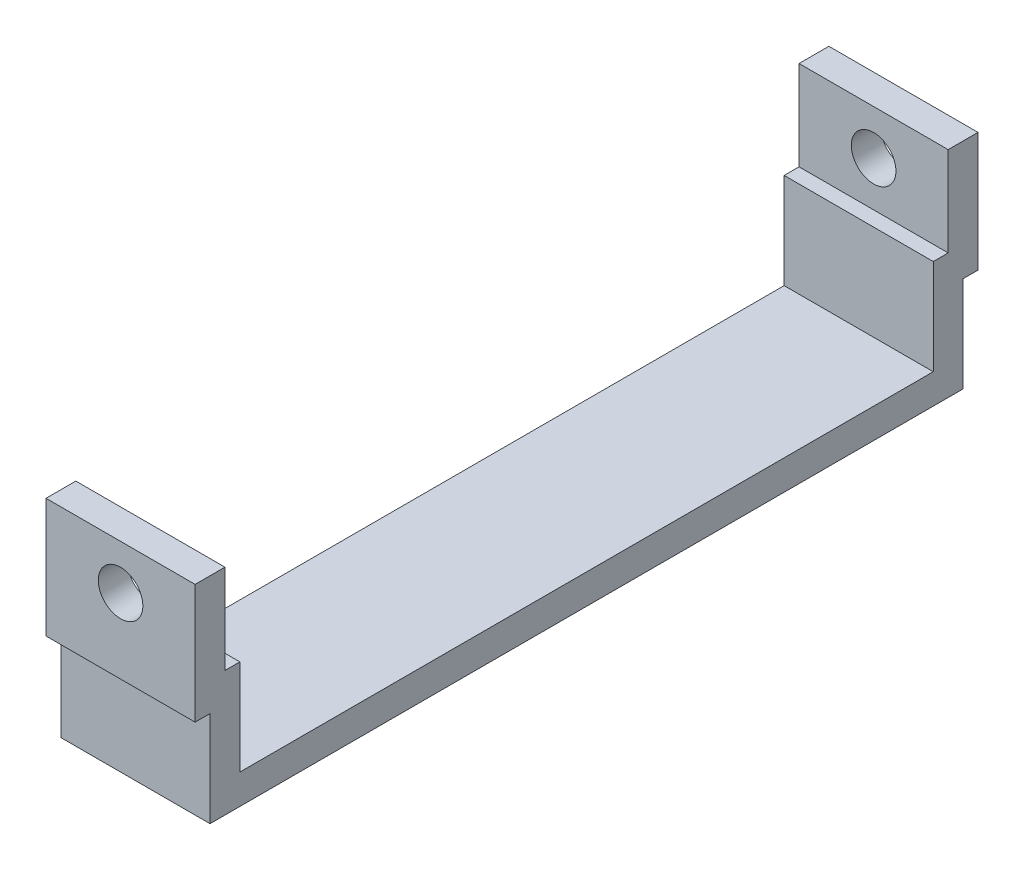
from build123d import *

# Parameters (mm, degrees)
EXTRUDE_THIN1_DEPTH       = 12.7
F_6_CLEARANCE_HOLE1_D     = 3.7973
F_6_CLEARANCE_HOLE1_DEPTH = 7.62
F_6_CLEARANCE_HOLE1_TIP   = 1.140824014
F_6_CLEARANCE_HOLE2_D     = 3.7973
F_6_CLEARANCE_HOLE2_DEPTH = 7.62
F_6_CLEARANCE_HOLE2_TIP   = 1.140824014


with BuildPart() as part:
    # Sketch1 → Extrude-Thin1 (new body)
    with BuildSketch(Plane(origin=(0, 0, 0), x_dir=(0, 0, -1), z_dir=(1, 0, 0))):
        Polygon((-1.27, 15.748), (-1.27, 8.128), (0, 8.128), (0, 0), (59.055, 0), (59.055, 8.128), (60.325, 8.128), (60.325, 15.748), (62.865, 15.748), (62.865, 5.588), (61.595, 5.588), (61.595, -2.54), (-2.54, -2.54), (-2.54, 5.588), (-3.81, 5.588), (-3.81, 15.748), align=None)
    extrude(amount=EXTRUDE_THIN1_DEPTH)

    # #6 Clearance Hole1
    with Locations(Plane(origin=(0, 0, 1.27), x_dir=(-1, 0, 0), z_dir=(0, 0, -1))):
        with Locations((-6.35, 11.938)):
            Hole(F_6_CLEARANCE_HOLE1_D / 2, depth=F_6_CLEARANCE_HOLE1_DEPTH)
            with Locations((0, 0, -(F_6_CLEARANCE_HOLE1_DEPTH + F_6_CLEARANCE_HOLE1_TIP / 2))):  # 118° drill point
                Cone(0, F_6_CLEARANCE_HOLE1_D / 2, F_6_CLEARANCE_HOLE1_TIP, mode=Mode.SUBTRACT)

    # #6 Clearance Hole2
    with Locations(Plane.XY.offset(-60.325)):
        with Locations((6.35, 11.938)):
            Hole(F_6_CLEARANCE_HOLE2_D / 2, depth=F_6_CLEARANCE_HOLE2_DEPTH)
            with Locations((0, 0, -(F_6_CLEARANCE_HOLE2_DEPTH + F_6_CLEARANCE_HOLE2_TIP / 2))):  # 118° drill point
                Cone(0, F_6_CLEARANCE_HOLE2_D / 2, F_6_CLEARANCE_HOLE2_TIP, mode=Mode.SUBTRACT)


solid = part.part
